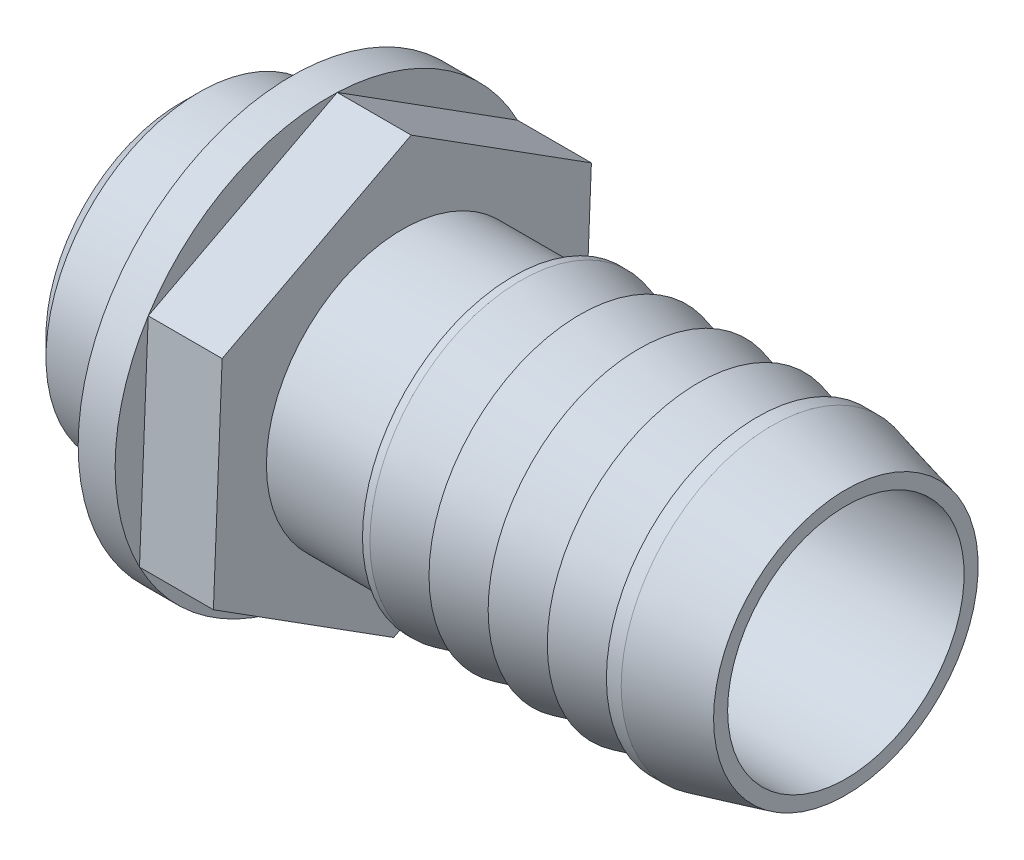
from build123d import *

# Parameters (mm, degrees)
CHAMFER1_SIZE    = 0.79375
CHAMFER1_SIZE2   = 3.175
EXTRUSION1_DEPTH = 3.175
ESQUISSE3_R      = 9.165435523
EXTRUSION2_DEPTH = 1.5875
ESQUISSE4_R      = 6.5786
THREAD1_DEPTH    = 4.7625
CHAMFER2_SIZE    = 0.79375
HOLE1_D          = 10.16


with BuildPart() as part:
    # Esquisse1 → Revolution1 (revolve)
    with BuildSketch(Plane.XY, mode=Mode.PRIVATE) as revolution1_sk:
        Polygon((0, 5.08), (19.05, 5.08), (19.05, 6.477), (15.24, 6.477), (15.24, 5.842), (12.7, 6.477), (12.7, 5.842), (10.16, 6.477), (10.16, 5.842), (7.62, 6.477), (7.62, 5.842), (5.08, 6.477), (4.7625, 6.477), (4.7625, 5.842), (0, 5.842), align=None)
    revolve(revolution1_sk.sketch.rotate(Axis((0, 0, 0), (1, 0, 0)), 90), axis=Axis((0, 0, 0), (1, 0, 0)))

    # Chamfer1
    chamfer1_edges = [part.edges().sort_by_distance(p)[0] for p in [
        (19.05, 0, -6.477),
    ]]
    chamfer1_side = [part.faces().sort_by_distance(p)[0] for p in [
        (19.05, 0, -5.263197225),
    ]]
    chamfer(chamfer1_edges, length=CHAMFER1_SIZE, length2=CHAMFER1_SIZE2, reference=chamfer1_side[0])

    # Esquisse2 → Extrusion1 (add)
    with BuildSketch(Plane.ZY):
        Polygon((0.375877143, -9.157724865), (-7.742883803, -4.904381587), (-8.118760946, 4.253343278), (-0.375877143, 9.157724865), (7.742883803, 4.904381587), (8.118760946, -4.253343278), align=None)
    extrude(amount=EXTRUSION1_DEPTH)

    # Esquisse3 → Extrusion2 (add)
    with BuildSketch(Plane.ZY.offset(3.175)):
        with Locations(Location((0, 0, 0), (0, 0, 152.350375514))):
            Circle(ESQUISSE3_R)
    extrude(amount=EXTRUSION2_DEPTH)

    # Esquisse4 → Thread1 (add)
    with BuildSketch(Plane.ZY.offset(4.7625)):
        with Locations(Location((0, 0, 0), (0, 0, 180))):
            Circle(ESQUISSE4_R)
    extrude(amount=THREAD1_DEPTH)

    # Chamfer2
    chamfer2_edges = [part.edges().sort_by_distance(p)[0] for p in [
        (-9.525, 0, 6.5786),
    ]]
    chamfer(chamfer2_edges, length=CHAMFER2_SIZE)

    # Hole1 (through all)
    with Locations(Plane.ZY.offset(9.525)):
        with Locations((0, 0)):
            Hole(HOLE1_D / 2)


solid = part.part
